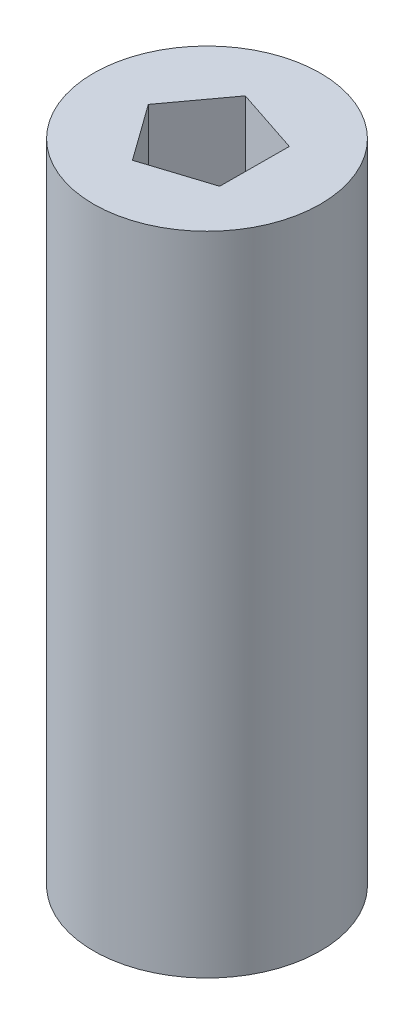
from build123d import *

# Parameters (mm, degrees)
SKETCH1_R           = 5
SKETCH1_R_2         = 2.6
BOSS_EXTRUDE1_DEPTH = 8
BOSS_EXTRUDE2_START = 6
SKETCH2_R           = 5
SKETCH2_R_2         = 2.175
BOSS_EXTRUDE2_DEPTH = 6
BOSS_EXTRUDE3_START = 1.5
SKETCH3_R           = 5
BOSS_EXTRUDE3_DEPTH = 1.5
BOSS_EXTRUDE4_START = 13
SKETCH4_R           = 5
BOSS_EXTRUDE4_DEPTH = 13


with BuildPart() as part:
    # Sketch1 → Boss-Extrude1 (new body)
    # profile 1 of 6: a face of its own
    with BuildSketch(Plane(origin=(0, 0, 0), x_dir=(1, 0, 0), z_dir=(0, 1, 0))):
        with Locations(Location((0, 0, 0), (0, 0, 270))):
            Circle(SKETCH1_R)
        Circle(SKETCH1_R_2, mode=Mode.SUBTRACT)
    # profile 2 of 6: a face of its own
    with BuildSketch(Plane(origin=(0, 0, 0), x_dir=(1, 0, 0), z_dir=(0, 1, 0))):
        with BuildLine():
            Line((2.111719424, 1.51678643), (2.095106807, -1.539651735))
            ThreePointArc((2.095106807, -1.539651735), (2.470554361, -0.810161188), (2.6, 0))
            ThreePointArc((2.6, 0), (2.474921262, 0.796721249), (2.111719424, 1.51678643))
        make_face()
    # profile 3 of 6: a face of its own
    with BuildSketch(Plane(origin=(0, 0, 0), x_dir=(1, 0, 0), z_dir=(0, 1, 0))):
        with BuildLine():
            ThreePointArc((-0.816872207, -2.468343533), (0.789992429, -2.477077303), (2.095106807, -1.539651735))
            Line((2.095106807, -1.539651735), (-0.816872207, -2.468343533))
        make_face()
    # profile 4 of 6: a face of its own
    with BuildSketch(Plane(origin=(0, 0, 0), x_dir=(1, 0, 0), z_dir=(0, 1, 0))):
        with BuildLine():
            ThreePointArc((-2.599961596, 0.014131536), (-2.111719424, -1.51678643), (-0.816872207, -2.468343533))
            Line((-0.816872207, -2.468343533), (-2.599961596, 0.014131536))
        make_face()
    # profile 5 of 6: a face of its own
    with BuildSketch(Plane(origin=(0, 0, 0), x_dir=(1, 0, 0), z_dir=(0, 1, 0))):
        with BuildLine():
            Line((-2.599961596, 0.014131536), (-0.789992429, 2.477077303))
            ThreePointArc((-0.789992429, 2.477077303), (-2.095106807, 1.539651735), (-2.599961596, 0.014131536))
        make_face()
    # profile 6 of 6: a face of its own
    with BuildSketch(Plane(origin=(0, 0, 0), x_dir=(1, 0, 0), z_dir=(0, 1, 0))):
        with BuildLine():
            Line((-0.789992429, 2.477077303), (2.111719424, 1.51678643))
            ThreePointArc((2.111719424, 1.51678643), (0.816872207, 2.468343533), (-0.789992429, 2.477077303))
        make_face()
    extrude(amount=BOSS_EXTRUDE1_DEPTH)

    # Sketch2 → Boss-Extrude2 (add)
    with BuildSketch(Plane.XZ.offset(BOSS_EXTRUDE2_START)):
        with Locations(Location((0, 0, 0), (0, 0, 270))):
            Circle(SKETCH2_R)
        with Locations(Location((0, 0, 0), (0, 0, 87.049070531))):
            Circle(SKETCH2_R_2, mode=Mode.SUBTRACT)
    extrude(amount=-BOSS_EXTRUDE2_DEPTH)

    # Sketch3 → Boss-Extrude3 (add)
    with BuildSketch(Plane.XZ.offset(6).offset(BOSS_EXTRUDE3_START)):
        with Locations(Location((0, 0, 0), (0, 0, 270))):
            Circle(SKETCH3_R)
    extrude(amount=-BOSS_EXTRUDE3_DEPTH)

    # Sketch4 → Boss-Extrude4 (add)
    with BuildSketch(Plane.XZ.offset(7.5).offset(BOSS_EXTRUDE4_START)):
        with Locations(Location((0, 0, 0), (0, 0, 270))):
            Circle(SKETCH4_R)
        with BuildLine():
            Line((-1.747140521, 2.5), (1.747140521, 2.5))
            ThreePointArc((1.747140521, 2.5), (0, -3.05), (-1.747140521, 2.5))
        make_face(mode=Mode.SUBTRACT)
    extrude(amount=-BOSS_EXTRUDE4_DEPTH)


solid = part.part
